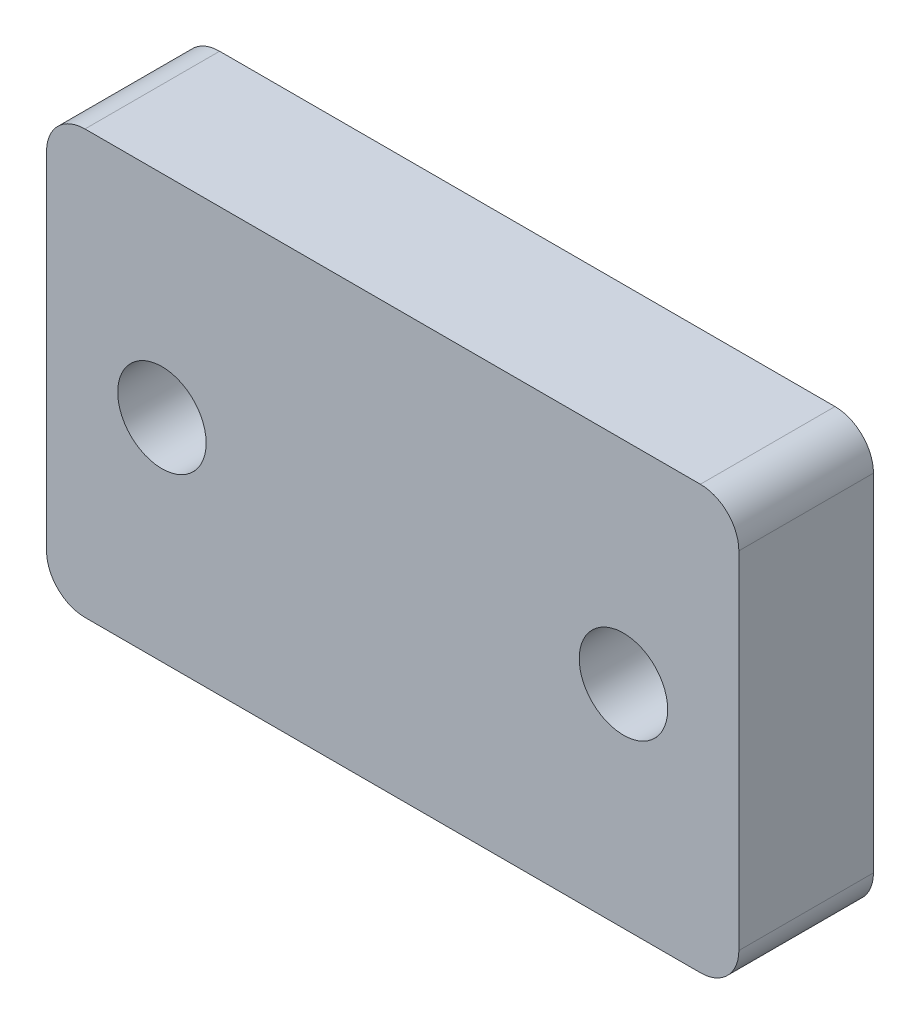
from build123d import *

# Parameters (mm, degrees)
SKETCH_1_W      = 18
SKETCH_1_H      = 11
SKETCH_1_R      = 1.15
EXTRUDE_1_DEPTH = 3.5
FILLET_1_R      = 1


with BuildPart() as part:
    # 草图1 → 凸台-拉伸1 (new body)
    with BuildSketch(Plane.XY):
        with Locations((9, 5.5)):
            Rectangle(SKETCH_1_W, SKETCH_1_H)
        with Locations((3, 5.5)):
            Circle(SKETCH_1_R, mode=Mode.SUBTRACT)
        with Locations((15, 5.5)):
            Circle(SKETCH_1_R, mode=Mode.SUBTRACT)
    extrude(amount=EXTRUDE_1_DEPTH)

    # 圆角1
    fillet_1_edges = [part.edges().sort_by_distance(p)[0] for p in [
        (0, 11, 1.75),
        (18, 11, 1.75),
        (18, 0, 1.75),
        (0, 0, 1.75),
    ]]
    fillet(fillet_1_edges, radius=FILLET_1_R)


solid = part.part
